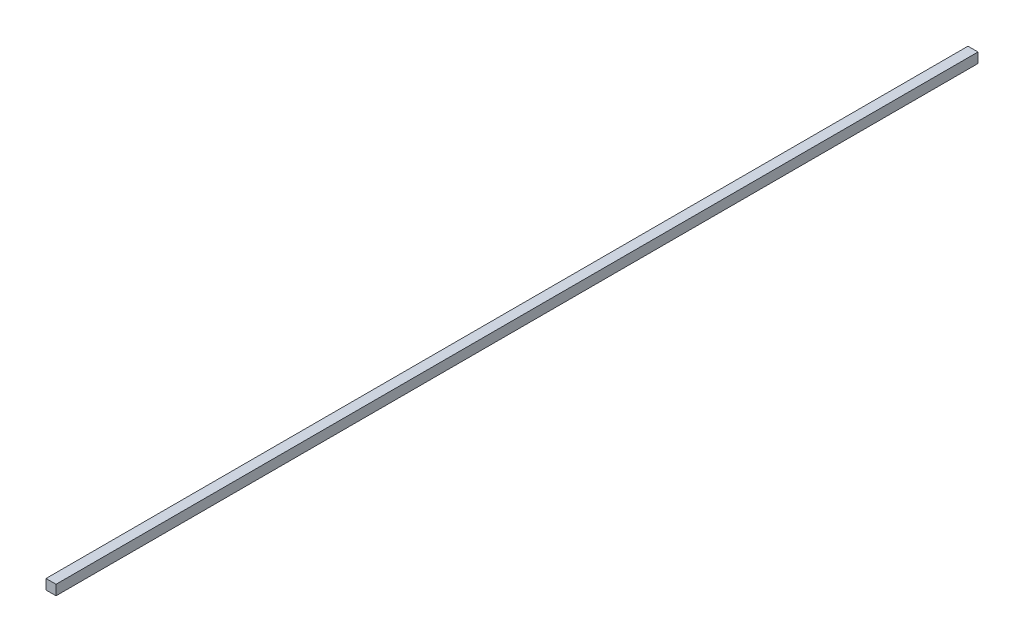
from build123d import *

# Parameters (mm, degrees)
SKETCH1_W           = 25.4
SKETCH1_H           = 25.4
BOSS_EXTRUDE1_DEPTH = 2336.8


with BuildPart() as part:
    # Sketch1 → Boss-Extrude1 (new body)
    with BuildSketch(Plane.XY):
        Rectangle(SKETCH1_W, SKETCH1_H)
    extrude(amount=-BOSS_EXTRUDE1_DEPTH)


solid = part.part
